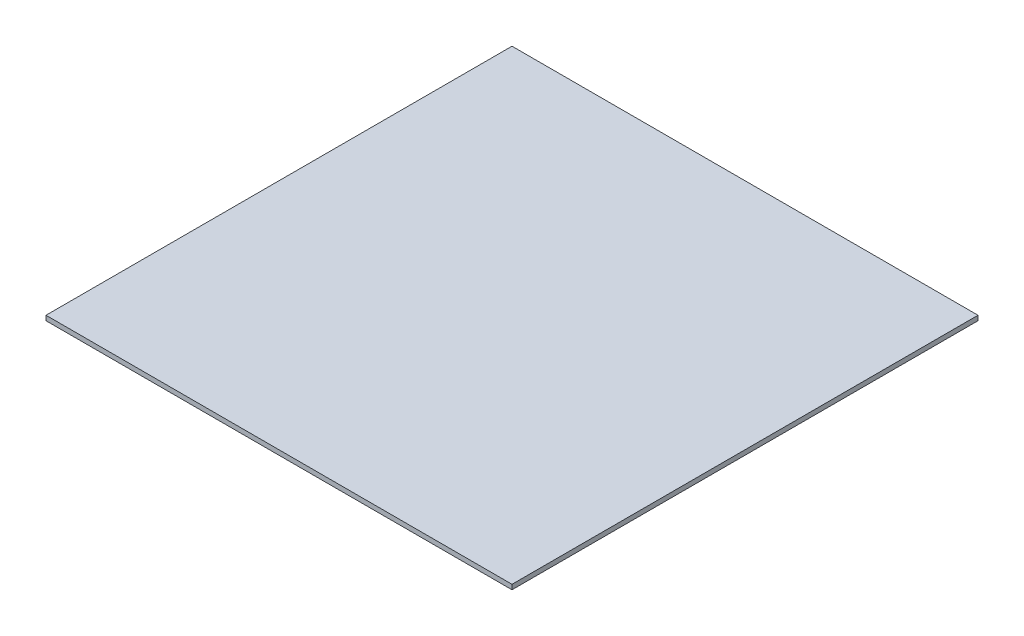
from build123d import *

# Parameters (mm, degrees)
SKETCH1_W           = 390
SKETCH1_H           = 390
BOSS_EXTRUDE1_DEPTH = 4


with BuildPart() as part:
    # Sketch1 → Boss-Extrude1 (new body)
    with BuildSketch(Plane(origin=(0, 0, 0), x_dir=(1, 0, 0), z_dir=(0, 1, 0))):
        Rectangle(SKETCH1_W, SKETCH1_H)
    extrude(amount=BOSS_EXTRUDE1_DEPTH)


solid = part.part
